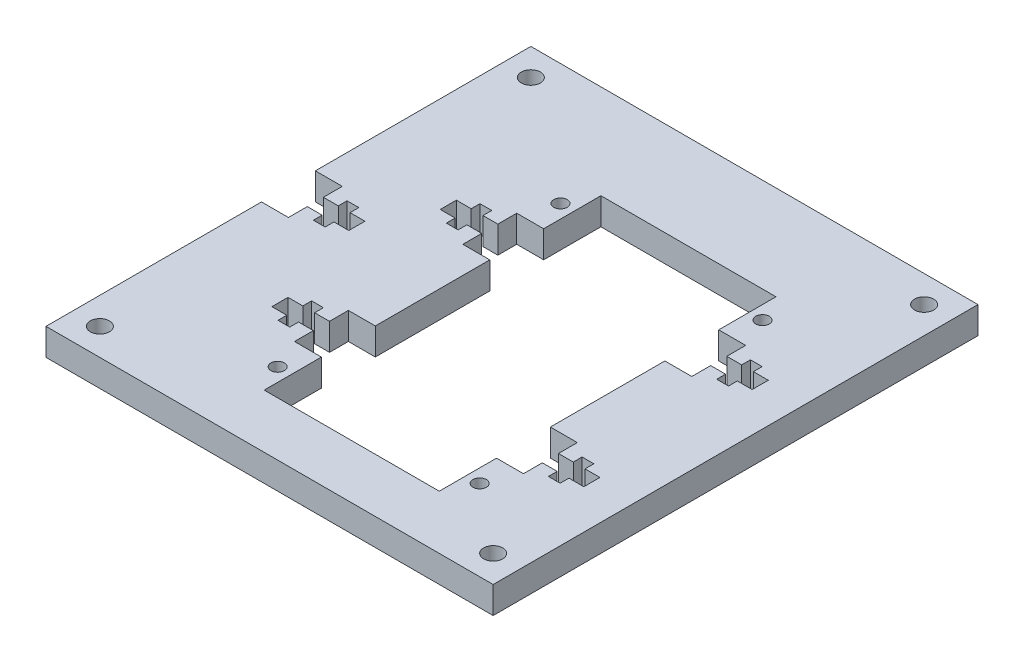
from build123d import *

# Parameters (mm, degrees)
SKETCH1_W             = 105.41
SKETCH1_H             = 114.3
BOSS_EXTRUDE1_DEPTH   = 3.175
F_8_CLEARANCE_HOLE1_D = 4.4958
MIRROR2_COPY_1_D      = 4.4958
CUT_EXTRUDE4_REACH    = 80.002
SKETCH15_W            = 41.275
SKETCH15_H            = 79.375
CUT_EXTRUDE5_REACH    = 80.002
SKETCH17_R            = 1.5875
CUT_EXTRUDE6_DEPTH    = 6.35


with BuildPart() as part:
    # Sketch1 → Boss-Extrude1 (new, symmetric)
    with BuildSketch(Plane(origin=(0, 0, 0), x_dir=(1, 0, 0), z_dir=(0, 1, 0))):
        Rectangle(SKETCH1_W, SKETCH1_H)
    extrude(amount=BOSS_EXTRUDE1_DEPTH, both=True)

    # #8 Clearance Hole1 (through all)
    with Locations(Plane(origin=(0, 3.175, 0), x_dir=(1, 0, 0), z_dir=(0, 1, 0))):
        with Locations((-46.355, 50.8)):
            f_8_clearance_hole1 = Hole(F_8_CLEARANCE_HOLE1_D / 2)

    # Mirror1: #8 Clearance Hole1 across plane
    add(f_8_clearance_hole1.mirror(Plane.XY), mode=Mode.SUBTRACT)

    # Mirror2: #8 Clearance Hole1 across plane
    add(f_8_clearance_hole1.mirror(Plane(origin=(0, 0, 0), x_dir=(0, 0, 1), z_dir=(1, 0, 0))), mode=Mode.SUBTRACT)

    # Mirror2 copy 1 (through all)
    with Locations(Plane(origin=(0, 3.175, 0), x_dir=(-1, 0, 0), z_dir=(0, 1, 0))):
        with Locations((-46.355, 50.8)):
            Hole(MIRROR2_COPY_1_D / 2)

    # Sketch15 → Cut-Extrude4 (cut, up to next)
    with BuildSketch(Plane.XZ.offset(3.175), mode=Mode.PRIVATE) as cut_extrude4_sk1:
        with Locations((6.6675, 4.7625)):
            Rectangle(SKETCH15_W, SKETCH15_H)
    cut_extrude4_tool1 = extrude(cut_extrude4_sk1.sketch, amount=-CUT_EXTRUDE4_REACH, mode=Mode.PRIVATE) & part.part
    add(cut_extrude4_tool1.solids().sort_by_distance((6.6675, -3.175, 4.7625))[0], mode=Mode.SUBTRACT)

    # Sketch16 → Cut-Extrude5 (cut, up to next)
    with BuildSketch(Plane(origin=(0, 3.175, 0), x_dir=(1, 0, 0), z_dir=(0, 1, 0)), mode=Mode.PRIVATE) as cut_extrude5_sk1:
        Polygon((-52.705, -6.35), (-52.705, 6.35), (-46.355, 6.35), (-46.355, 1.89865), (-42.8545625, 1.89865), (-42.8545625, 3.96875), (-40.0764375, 3.96875), (-40.0764375, 1.89865), (-36.576, 1.89865), (-36.576, -1.89865), (-40.0764375, -1.89865), (-40.0764375, -3.96875), (-42.8545625, -3.96875), (-42.8545625, -1.89865), (-46.355, -1.89865), (-46.355, -6.35), align=None)
    cut_extrude5_tool1 = extrude(cut_extrude5_sk1.sketch, amount=-CUT_EXTRUDE5_REACH, mode=Mode.PRIVATE) & part.part
    add(cut_extrude5_tool1.solids().sort_by_distance((-46.496113, 3.175, 0))[0], mode=Mode.SUBTRACT)

    # Sketch17 → Cut-Extrude6 (cut)
    with BuildSketch(Plane(origin=(0, 3.175, 0), x_dir=(1, 0, 0), z_dir=(0, 1, 0))):
        with Locations(Location((-17.145, 28.575, 0), (0, 0, 270))):
            Circle(SKETCH17_R)
        with Locations(Location((-17.145, -38.1, 0), (0, 0, 270))):
            Circle(SKETCH17_R)
        with Locations(Location((30.48, -38.1, 0), (0, 0, 90))):
            Circle(SKETCH17_R)
        with Locations(Location((30.48, 28.575, 0), (0, 0, 90))):
            Circle(SKETCH17_R)
        Polygon((-20.32, 8.73125), (-13.97, 8.73125), (-13.97, 21.43125), (-20.32, 21.43125), (-20.32, 16.9799), (-23.8204375, 16.9799), (-23.8204375, 19.05), (-26.5985625, 19.05), (-26.5985625, 16.9799), (-30.099, 16.9799), (-30.099, 13.1826), (-26.5985625, 13.1826), (-26.5985625, 11.1125), (-23.8204375, 11.1125), (-23.8204375, 13.1826), (-20.32, 13.1826), align=None)
        Polygon((33.655, -18.25625), (27.305, -18.25625), (27.305, -30.95625), (33.655, -30.95625), (33.655, -26.5049), (37.1554375, -26.5049), (37.1554375, -28.575), (39.9335625, -28.575), (39.9335625, -26.5049), (43.434, -26.5049), (43.434, -22.7076), (39.9335625, -22.7076), (39.9335625, -20.6375), (37.1554375, -20.6375), (37.1554375, -22.7076), (33.655, -22.7076), align=None)
        Polygon((-20.32, -26.5049), (-20.32, -30.95625), (-13.97, -30.95625), (-13.97, -18.25625), (-20.32, -18.25625), (-20.32, -22.7076), (-23.8204375, -22.7076), (-23.8204375, -20.6375), (-26.5985625, -20.6375), (-26.5985625, -22.7076), (-30.099, -22.7076), (-30.099, -26.5049), (-26.5985625, -26.5049), (-26.5985625, -28.575), (-23.8204375, -28.575), (-23.8204375, -26.5049), align=None)
        Polygon((33.655, 16.9799), (33.655, 21.43125), (27.305, 21.43125), (27.305, 8.73125), (33.655, 8.73125), (33.655, 13.1826), (37.1554375, 13.1826), (37.1554375, 11.1125), (39.9335625, 11.1125), (39.9335625, 13.1826), (43.434, 13.1826), (43.434, 16.9799), (39.9335625, 16.9799), (39.9335625, 19.05), (37.1554375, 19.05), (37.1554375, 16.9799), align=None)
    extrude(amount=-CUT_EXTRUDE6_DEPTH, mode=Mode.SUBTRACT)


solid = part.part
